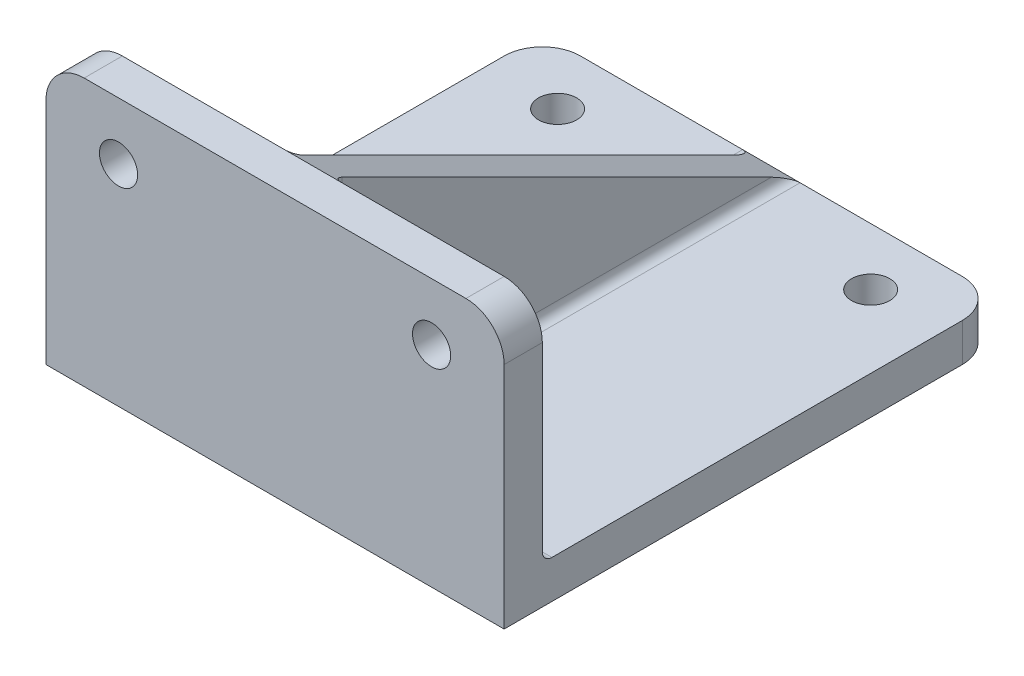
from build123d import *

# Parameters (mm, degrees)
EXTRUDE_THIN1_DEPTH = 76.2
FILLET1_R           = 6.35
SKETCH2_R           = 3.175
CUT_EXTRUDE1_DEPTH  = 76.2
SKETCH3_R           = 3.175
CUT_EXTRUDE2_DEPTH  = 115.3
BOSS_EXTRUDE1_REACH = 106.302
SKETCH4_W           = 6.35
SKETCH4_H           = 85.194189943
FILLET2_R           = 1.6002


with BuildPart() as part:
    # Sketch1 → Extrude-Thin1 (new body)
    with BuildSketch(Plane(origin=(0, 0, 0), x_dir=(0, 0, -1), z_dir=(1, 0, 0))):
        Polygon((76.2, 0), (0, 0), (0, 38.1), (-6.35, 38.1), (-6.35, -6.35), (76.2, -6.35), align=None)
    extrude(amount=EXTRUDE_THIN1_DEPTH)

    # Fillet1
    fillet1_edges = [part.edges().sort_by_distance(p)[0] for p in [
        (76.2, -3.175, -76.2),
        (0, -3.175, -76.2),
        (0, 38.1, 3.175),
        (76.2, 38.1, 3.175),
    ]]
    fillet(fillet1_edges, radius=FILLET1_R)

    # Sketch2 → Cut-Extrude1 (cut)
    with BuildSketch(Plane.XY):
        with Locations(Location((12.065, 28.575, 0), (0, 0, 180))):
            Circle(SKETCH2_R)
        with Locations(Location((64.135, 28.575, 0), (0, 0, 180))):
            Circle(SKETCH2_R)
    extrude(amount=CUT_EXTRUDE1_DEPTH, mode=Mode.SUBTRACT)

    # Sketch3 → Cut-Extrude2 (cut, through all)
    with BuildSketch(Plane(origin=(0, 0, 0), x_dir=(1, 0, 0), z_dir=(0, 1, 0))):
        with Locations(Location((12.065, 66.675, 0), (0, 0, 270))):
            Circle(SKETCH3_R)
        with Locations(Location((64.135, 66.675, 0), (0, 0, 90))):
            Circle(SKETCH3_R)
    extrude(amount=-CUT_EXTRUDE2_DEPTH, mode=Mode.SUBTRACT)

    # Sketch4 → Boss-Extrude1 (add, up to next)
    with BuildSketch(Plane(origin=(0, 30.48, -15.24), x_dir=(1, 0, 0), z_dir=(0, -0.894427190999916, 0.4472135954999579)), mode=Mode.PRIVATE) as boss_extrude1_sk1:
        with Locations((38.1, -25.558256983)):
            Rectangle(SKETCH4_W, SKETCH4_H)
    boss_extrude1_tool1 = extrude(boss_extrude1_sk1.sketch, amount=BOSS_EXTRUDE1_REACH, mode=Mode.PRIVATE) - part.part
    add(boss_extrude1_tool1.solids().sort_by_distance((38.1, 19.05, -38.1))[0])

    # Fillet2
    fillet2_edges = [part.edges().sort_by_distance(p)[0] for p in [
        (17.4625, 0, 0),
        (41.275, 19.05, 0),
        (34.925, 19.05, 0),
        (41.275, 0, -38.1),
        (34.925, 0, -38.1),
        (58.7375, 0, 0),
    ]]
    fillet(fillet2_edges, radius=FILLET2_R)


solid = part.part
